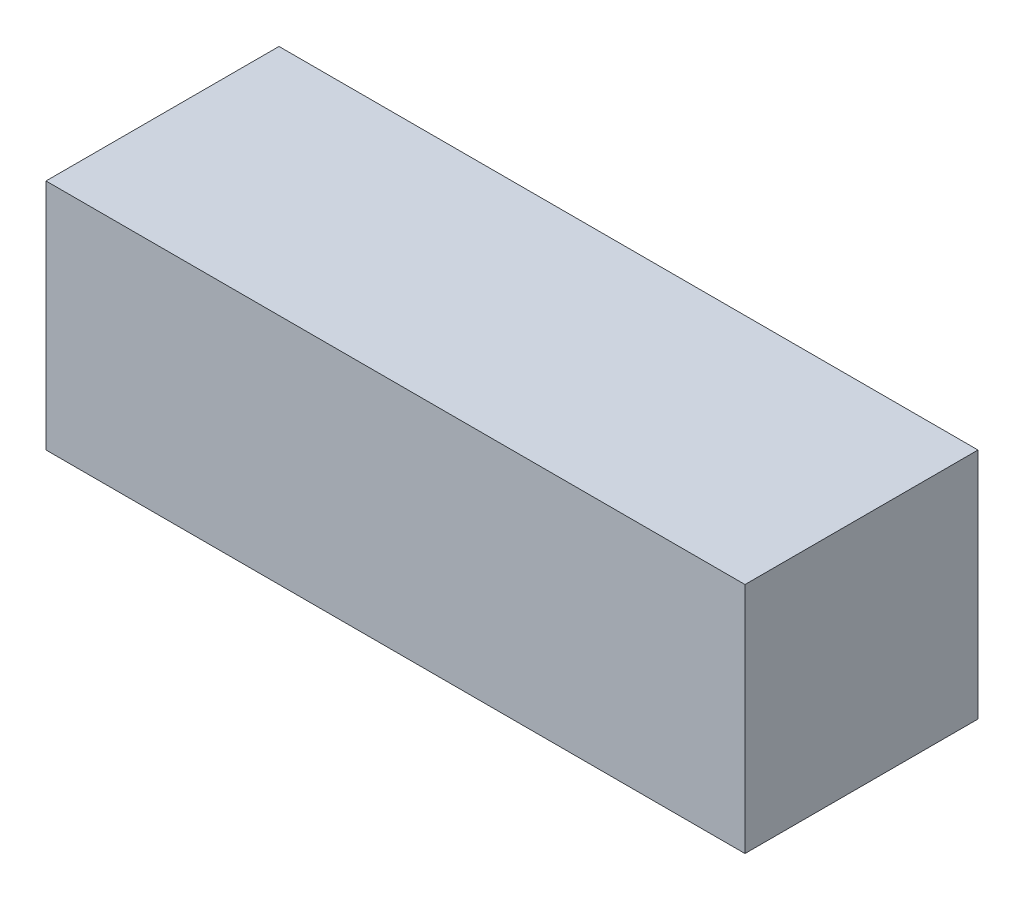
from build123d import *

# Parameters (mm, degrees)
SKETCH1_W           = 30
SKETCH1_H           = 10
BOSS_EXTRUDE1_DEPTH = 10


with BuildPart() as part:
    # Sketch1 → Boss-Extrude1 (new body)
    with BuildSketch(Plane(origin=(0, 0, 0), x_dir=(1, 0, 0), z_dir=(0, 1, 0))):
        with Locations((15, 5)):
            Rectangle(SKETCH1_W, SKETCH1_H)
    extrude(amount=BOSS_EXTRUDE1_DEPTH)


solid = part.part
